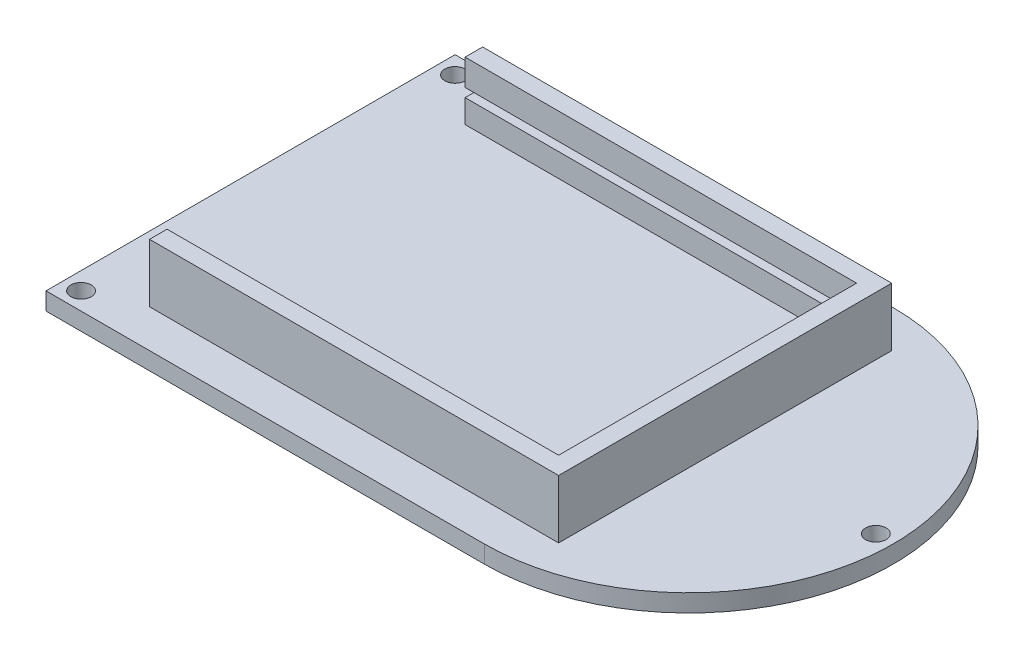
from build123d import *

# Parameters (mm, degrees)
CROQUIS1_R              = 1.75
SALIENTE_EXTRUIR1_DEPTH = 3
SALIENTE_EXTRUIR3_DEPTH = 10
CROQUIS4_W              = 70.682064062
CROQUIS4_H              = 54
CORTAR_EXTRUIR1_DEPTH   = 1.5


with BuildPart() as part:
    # Croquis1 → Saliente-Extruir1 (new body)
    with BuildSketch(Plane(origin=(0, 0, 0), x_dir=(1, 0, 0), z_dir=(0, 1, 0))):
        with BuildLine():
            Line((0, 35), (-75, 35))
            Line((-75, 35), (-75, -35))
            Line((-75, -35), (0, -35))
            ThreePointArc((0, -35), (35, 0), (0, 35))
        make_face()
        with Locations(Location((-72, 32, 0), (0, 0, 270))):
            Circle(CROQUIS1_R, mode=Mode.SUBTRACT)
        with Locations(Location((-72, -32, 0), (0, 0, 270))):
            Circle(CROQUIS1_R, mode=Mode.SUBTRACT)
        with Locations(Location((32, 0, 0), (0, 0, 270))):
            Circle(CROQUIS1_R, mode=Mode.SUBTRACT)
    extrude(amount=SALIENTE_EXTRUIR1_DEPTH)

    # Croquis3 → Saliente-Extruir3 (add)
    with BuildSketch(Plane(origin=(0, 3, 0), x_dir=(1, 0, 0), z_dir=(0, 1, 0))):
        Polygon((6.22052857, 28.5), (-63.77947143, 28.5), (-63.77947143, 25.5), (3.22052857, 25.5), (3.22052857, -25.5), (-63.77947143, -25.5), (-63.77947143, -28.5), (6.22052857, -28.5), align=None)
    extrude(amount=SALIENTE_EXTRUIR3_DEPTH)

    # Croquis4 → Cortar-Extruir1 (cut)
    with BuildSketch(Plane(origin=(0, 7, 0), x_dir=(1, 0, 0), z_dir=(0, 1, 0))):
        with Locations((-30.620503461, 0)):
            Rectangle(CROQUIS4_W, CROQUIS4_H)
    extrude(amount=CORTAR_EXTRUIR1_DEPTH, mode=Mode.SUBTRACT)


solid = part.part
